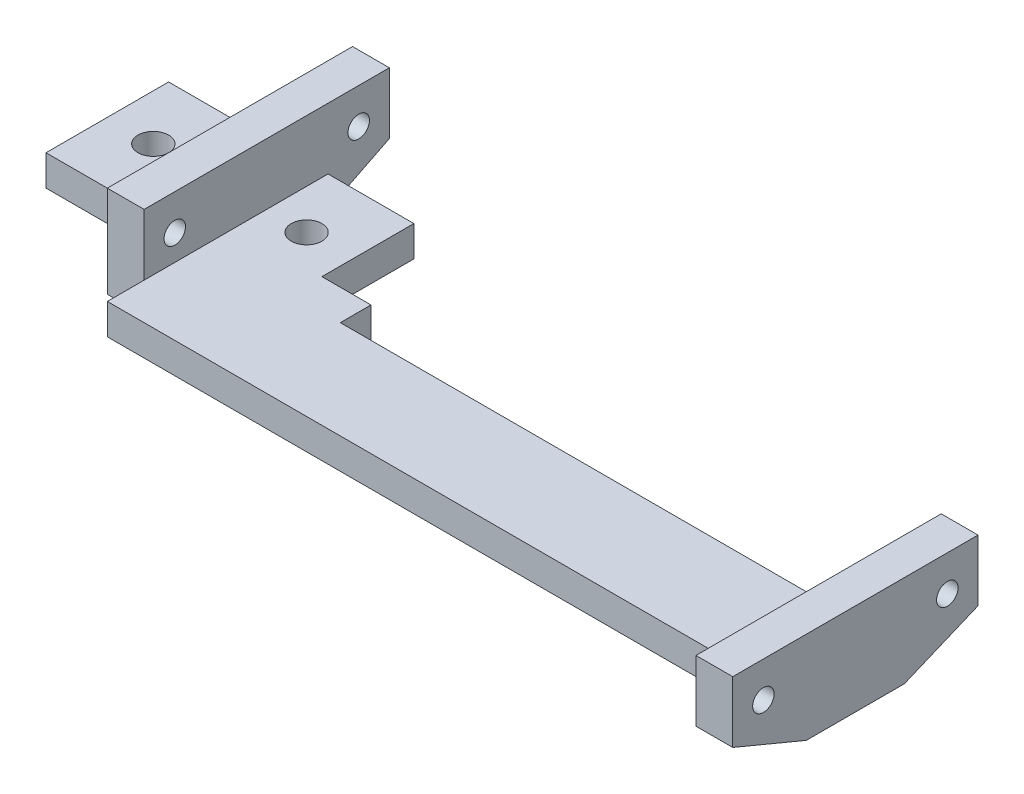
from build123d import *

# Parameters (mm, degrees)
EXTRUDE_1_DEPTH     = 5
SKETCH_2_R          = 1.75
EXTRUDE_2_DEPTH     = 6
SKETCH_3_W          = 20
SKETCH_3_H          = 5
EXTRUDE_3_DEPTH     = 20
SKETCH_4_R          = 2.5
CUT_EXTRUDE_1_DEPTH = 105.326410846
SKETCH_5_W          = 6
SKETCH_5_H          = 40
EXTRUDE_4_DEPTH     = 10
EXTRUDE_5_DEPTH     = 6
CUT_EXTRUDE_2_REACH = 126.599
SKETCH_8_R          = 1.75
EXTRUDE_6_DEPTH     = 10
CUT_EXTRUDE_3_REACH = 106.109
CUT_EXTRUDE_4_REACH = 117.472
SKETCH_16_W         = 6
SKETCH_16_H         = 6
CUT_EXTRUDE_5_DEPTH = 10
SKETCH_17_W         = 8
SKETCH_17_H         = 5
EXTRUDE_7_DEPTH     = 5


with BuildPart() as part:
    # 草图1 → 凸台-拉伸1 (new body)
    with BuildSketch(Plane(origin=(0, 0, 0), x_dir=(1, 0, 0), z_dir=(0, 1, 0))):
        Polygon((0, 0), (0, 20), (-20, 20), (-20, -16), (100, -16), (100, 0), align=None)
    extrude(amount=EXTRUDE_1_DEPTH)

    # 草图2 → 凸台-拉伸2 (add)
    with BuildSketch(Plane(origin=(100, 0, 0), x_dir=(0, 0, -1), z_dir=(1, 0, 0))):
        Polygon((-16, 0), (-28, 5), (-28, 15), (12, 15), (12, 5), (0, 0), align=None)
        with Locations((-23, 9.2)):
            Circle(SKETCH_2_R, mode=Mode.SUBTRACT)
        with Locations((7, 9.2)):
            Circle(SKETCH_2_R, mode=Mode.SUBTRACT)
    extrude(amount=-EXTRUDE_2_DEPTH)

    # 草图3 → 凸台-拉伸3 (add)
    with BuildSketch(Plane.ZY.offset(20)):
        with Locations((-10, 2.5)):
            Rectangle(SKETCH_3_W, SKETCH_3_H)
    extrude(amount=EXTRUDE_3_DEPTH)

    # 草图4 → 切除-拉伸1 (cut, through all)
    with BuildSketch(Plane(origin=(0, 5, 0), x_dir=(1, 0, 0), z_dir=(0, 1, 0))):
        with Locations(Location((-32.5, 10, 0), (0, 0, 270))):
            Circle(SKETCH_4_R)
        with Locations(Location((-7.5, 10, 0), (0, 0, 270))):
            Circle(SKETCH_4_R)
    extrude(amount=-CUT_EXTRUDE_1_DEPTH, mode=Mode.SUBTRACT)

    # 草图5 → 凸台-拉伸4 (add)
    with BuildSketch(Plane(origin=(0, 5, 0), x_dir=(1, 0, 0), z_dir=(0, 1, 0))):
        with Locations((-17, 10)):
            Rectangle(SKETCH_5_W, SKETCH_5_H)
    extrude(amount=EXTRUDE_4_DEPTH)

    # 草图7 → 凸台-拉伸5 (add)
    with BuildSketch(Plane.ZY.offset(20)):
        Polygon((-30, 5), (-20, 0), (-20, 5), align=None)
    extrude(amount=-EXTRUDE_5_DEPTH)

    # 草图8 → 切除-拉伸2 (cut, up to next)
    with BuildSketch(Plane.ZY.offset(20), mode=Mode.PRIVATE) as cut_extrude_2_sk1:
        with Locations((-25, 9.2)):
            Circle(SKETCH_8_R)
    cut_extrude_2_tool1 = extrude(cut_extrude_2_sk1.sketch, amount=-CUT_EXTRUDE_2_REACH, mode=Mode.PRIVATE) & part.part
    # 草图8 → 切除-拉伸2 (cut, up to next)
    with BuildSketch(Plane.ZY.offset(20), mode=Mode.PRIVATE) as cut_extrude_2_sk2:
        with Locations((5, 9.2)):
            Circle(SKETCH_8_R)
    cut_extrude_2_tool2 = extrude(cut_extrude_2_sk2.sketch, amount=-CUT_EXTRUDE_2_REACH, mode=Mode.PRIVATE) & part.part
    add(cut_extrude_2_tool1.solids().sort_by_distance((-20, 9.2, -25))[0], mode=Mode.SUBTRACT)
    add(cut_extrude_2_tool2.solids().sort_by_distance((-20, 9.2, 5))[0], mode=Mode.SUBTRACT)

    # 草图13 → 凸台-拉伸6 (add)
    with BuildSketch(Plane.ZY.offset(-94)):
        Polygon((-12, 5), (28, 5), (16, 0), (0, 0), align=None)
    extrude(amount=EXTRUDE_6_DEPTH)

    # 草图14 → 切除-拉伸3 (cut, up to next)
    with BuildSketch(Plane(origin=(41.704918033, 0, -34.754098361), x_dir=(-0.6401843996644796, 0, -0.7682212795973761), z_dir=(0.7682212795973761, 0, -0.6401843996644796)), mode=Mode.PRIVATE) as cut_extrude_3_sk1:
        Polygon((-66.067030045, 5), (-66.067030045, 0), (-81.687529397, 5), align=None)
    cut_extrude_3_tool1 = extrude(cut_extrude_3_sk1.sketch, amount=-CUT_EXTRUDE_3_REACH, mode=Mode.PRIVATE) & part.part
    add(cut_extrude_3_tool1.solids().sort_by_distance((87.333333, 3.333333, 20))[0], mode=Mode.SUBTRACT)

    # 草图15 → 切除-拉伸4 (cut, up to next)
    with BuildSketch(Plane(origin=(49.573770492, 0, 41.31147541), x_dir=(0.6401843996644798, 0, -0.768221279597376), z_dir=(0.768221279597376, 0, 0.6401843996644798)), mode=Mode.PRIVATE) as cut_extrude_4_sk1:
        Polygon((69.395988924, 5), (53.775489572, 0), (53.775489572, 5), align=None)
    cut_extrude_4_tool1 = extrude(cut_extrude_4_sk1.sketch, amount=-CUT_EXTRUDE_4_REACH, mode=Mode.PRIVATE) & part.part
    add(cut_extrude_4_tool1.solids().sort_by_distance((87.333333, 3.333333, -4))[0], mode=Mode.SUBTRACT)

    # 草图16 → 切除-拉伸5 (cut)
    with BuildSketch(Plane(origin=(0, 5, 0), x_dir=(1, 0, 0), z_dir=(0, 1, 0))):
        with Locations((-17, -13)):
            Rectangle(SKETCH_16_W, SKETCH_16_H)
    extrude(amount=-CUT_EXTRUDE_5_DEPTH, mode=Mode.SUBTRACT)

    # 草图17 → 凸台-拉伸7 (add)
    with BuildSketch(Plane(origin=(0, 0, 0), x_dir=(-1, 0, 0), z_dir=(0, 0, -1))):
        with Locations((-4, 2.5)):
            Rectangle(SKETCH_17_W, SKETCH_17_H)
    extrude(amount=EXTRUDE_7_DEPTH)


solid = part.part
